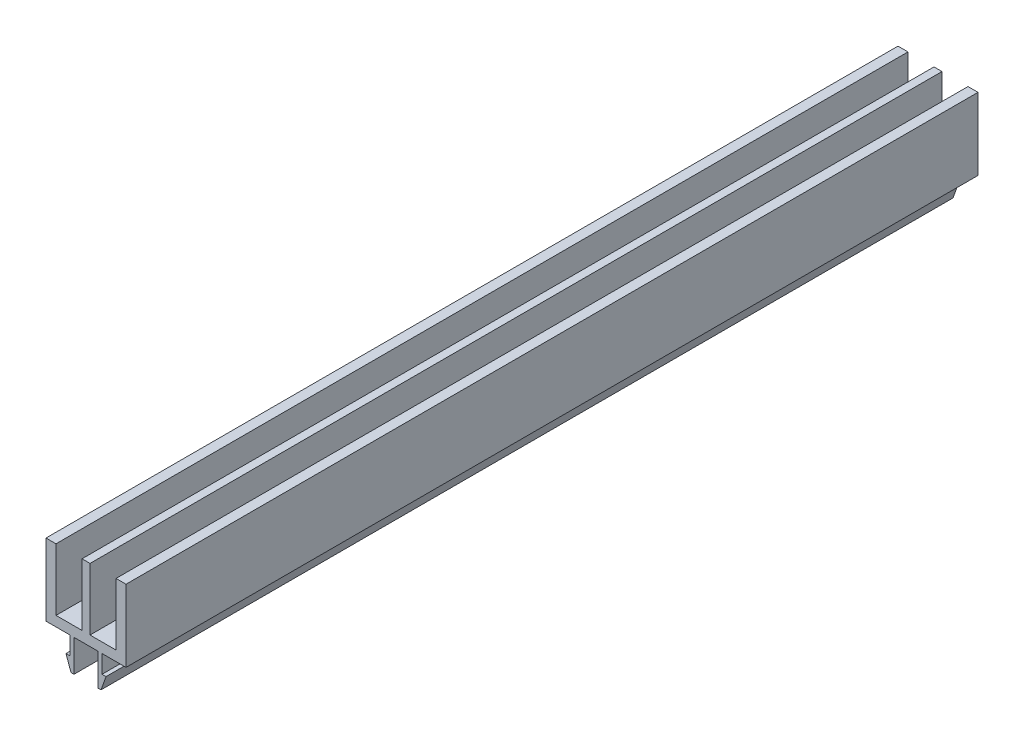
from build123d import *

# Parameters (mm, degrees)
BOSS_EXTRU_1_DEPTH = 212.95


with BuildPart() as part:
    # Esquisse1 → Boss.-Extru.1 (new body)
    with BuildSketch(Plane.XY.offset(50)):
        Polygon((-1, 2.5), (-7.5, 2.5), (-7.5, 17.999999998), (-10, 17.999999998), (-10, 0), (-4, 0), (-4, -4.5), (-5, -4.5), (-3.75, -8), (-3, -8), (-3, 0), (3, 0), (3, -8), (3.75, -8), (5, -4.5), (4, -4.5), (4, 0), (10, 0), (10, 17.999999998), (7.5, 17.999999998), (7.5, 2.5), (1, 2.5), (1, 17.999999998), (-1, 17.999999998), align=None)
    extrude(amount=-BOSS_EXTRU_1_DEPTH)


solid = part.part
